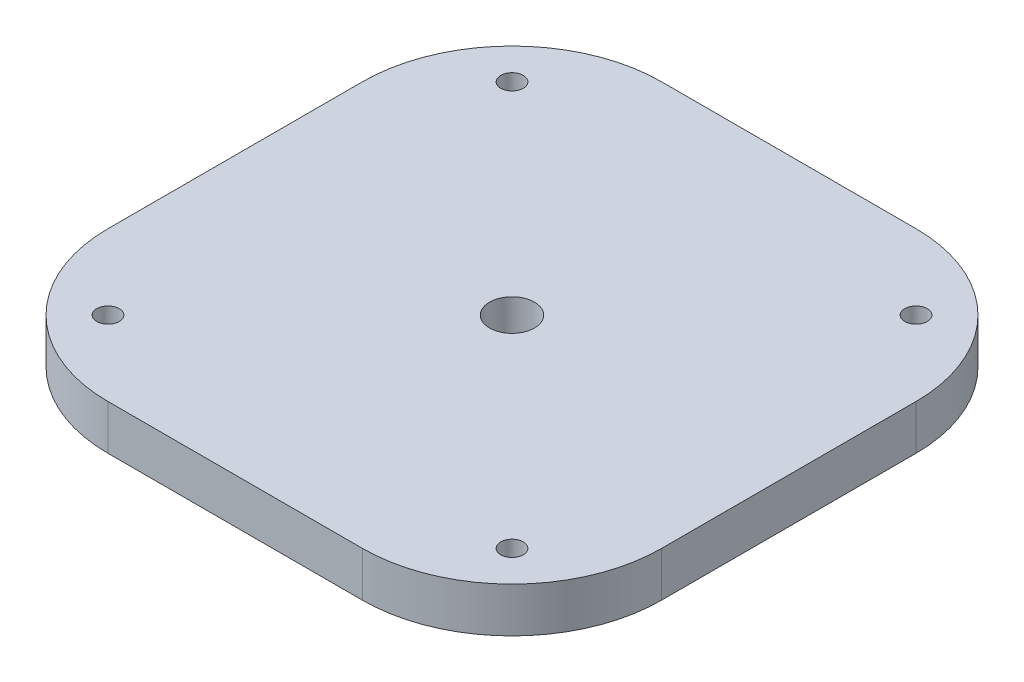
from build123d import *

# Parameters (mm, degrees)
EXTRUDE_1_DEPTH     = 6
SKETCH_2_R          = 1.5
SKETCH_2_R_2        = 3
CUT_EXTRUDE_1_DEPTH = 6
CUT_EXTRUDE_2_DEPTH = 2


with BuildPart() as part:
    # Эскиз1 → Бобышка-Вытянуть1 (new body)
    with BuildSketch(Plane(origin=(0, 0, 0), x_dir=(1, 0, 0), z_dir=(0, 1, 0))):
        with BuildLine():
            Line((17, -37), (-17, -37))
            ThreePointArc((-17, -37), (-31.142135624, -31.142135624), (-37, -17))
            Line((-37, -17), (-37, 17))
            ThreePointArc((-37, 17), (-31.142135624, 31.142135624), (-17, 37))
            Line((-17, 37), (17, 37))
            ThreePointArc((17, 37), (31.142135624, 31.142135624), (37, 17))
            Line((37, 17), (37, -17))
            ThreePointArc((37, -17), (31.142135624, -31.142135624), (17, -37))
        make_face()
    extrude(amount=EXTRUDE_1_DEPTH)

    # Эскиз2 → Вырез-Вытянуть1 (cut)
    with BuildSketch(Plane(origin=(0, 0, 0), x_dir=(1, 0, 0), z_dir=(0, 1, 0))):
        with Locations(Location((-27, 27, 0), (0, 0, 270))):
            Circle(SKETCH_2_R)
        with Locations(Location((27, 27, 0), (0, 0, 270))):
            Circle(SKETCH_2_R)
        with Locations(Location((27, -27, 0), (0, 0, 270))):
            Circle(SKETCH_2_R)
        with Locations(Location((-27, -27, 0), (0, 0, 270))):
            Circle(SKETCH_2_R)
        with Locations(Location((0, 0, 0), (0, 0, 270))):
            Circle(SKETCH_2_R_2)
    extrude(amount=CUT_EXTRUDE_1_DEPTH, mode=Mode.SUBTRACT)

    # Эскиз3 → Вырез-Вытянуть2 (cut)
    with BuildSketch(Plane(origin=(0, 0, 0), x_dir=(1, 0, 0), z_dir=(0, 1, 0))):
        Polygon((-28.732050808, 30), (-30.464101615, 27), (-28.732050808, 24), (-25.267949192, 24), (-23.535898385, 27), (-25.267949192, 30), align=None)
        Polygon((25.267949192, 30), (23.535898385, 27), (25.267949192, 24), (28.732050808, 24), (30.464101615, 27), (28.732050808, 30), align=None)
        Polygon((25.267949192, -24), (23.535898385, -27), (25.267949192, -30), (28.732050808, -30), (30.464101615, -27), (28.732050808, -24), align=None)
        Polygon((-28.732050808, -24), (-30.464101615, -27), (-28.732050808, -30), (-25.267949192, -30), (-23.535898385, -27), (-25.267949192, -24), align=None)
    extrude(amount=CUT_EXTRUDE_2_DEPTH, mode=Mode.SUBTRACT)


solid = part.part
